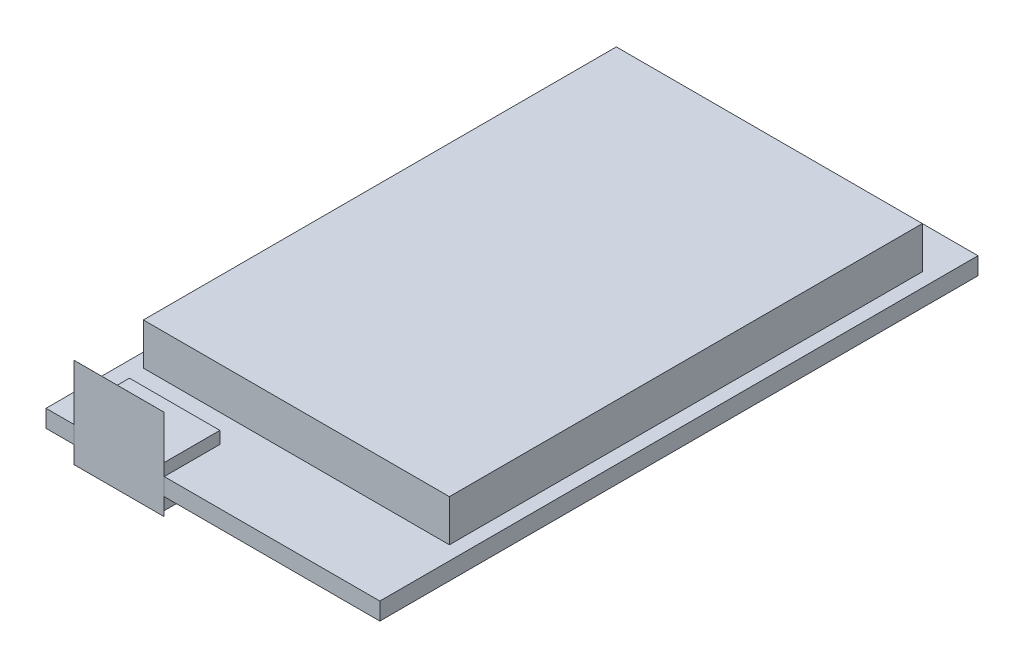
from build123d import *

# Parameters (mm, degrees)
SKETCH1_W               = 24
SKETCH1_H               = 43
PCB_DEPTH               = 1.25
SKETCH2_W               = 22
SKETCH2_H               = 34
RF_CASING_DEPTH         = 3
SKETCH3_W               = 6.5
SKETCH3_H               = 6.5
RF_CONNECTOR_BACK_DEPTH = 0.001
SKETCH5_W               = 6.5
SKETCH5_H               = 3
RF_CONNECTOR_PINS_DEPTH = 4


with BuildPart() as part:
    # Sketch1 → PCB (new body)
    with BuildSketch(Plane(origin=(0, 0, 0), x_dir=(1, 0, 0), z_dir=(0, 1, 0))):
        Rectangle(SKETCH1_W, SKETCH1_H)
    extrude(amount=PCB_DEPTH)

    # Sketch2 → RF Casing (add)
    with BuildSketch(Plane(origin=(0, 1.25, 0), x_dir=(1, 0, 0), z_dir=(0, 1, 0))):
        with Locations((0, 1.5)):
            Rectangle(SKETCH2_W, SKETCH2_H)
    extrude(amount=RF_CASING_DEPTH)

    # Sketch3 → RF Connector Back (add)
    with BuildSketch(Plane.XY.offset(21.5)):
        with Locations((-6.75, 2)):
            Rectangle(SKETCH3_W, SKETCH3_H)
    extrude(amount=RF_CONNECTOR_BACK_DEPTH)

    # Sketch5 → RF Connector Pins (add)
    with BuildSketch(Plane(origin=(0, 0, 21.5), x_dir=(-1, 0, 0), z_dir=(0, 0, -1))):
        with Locations((6.75, 0.625)):
            Rectangle(SKETCH5_W, SKETCH5_H)
    extrude(amount=RF_CONNECTOR_PINS_DEPTH)


solid = part.part
